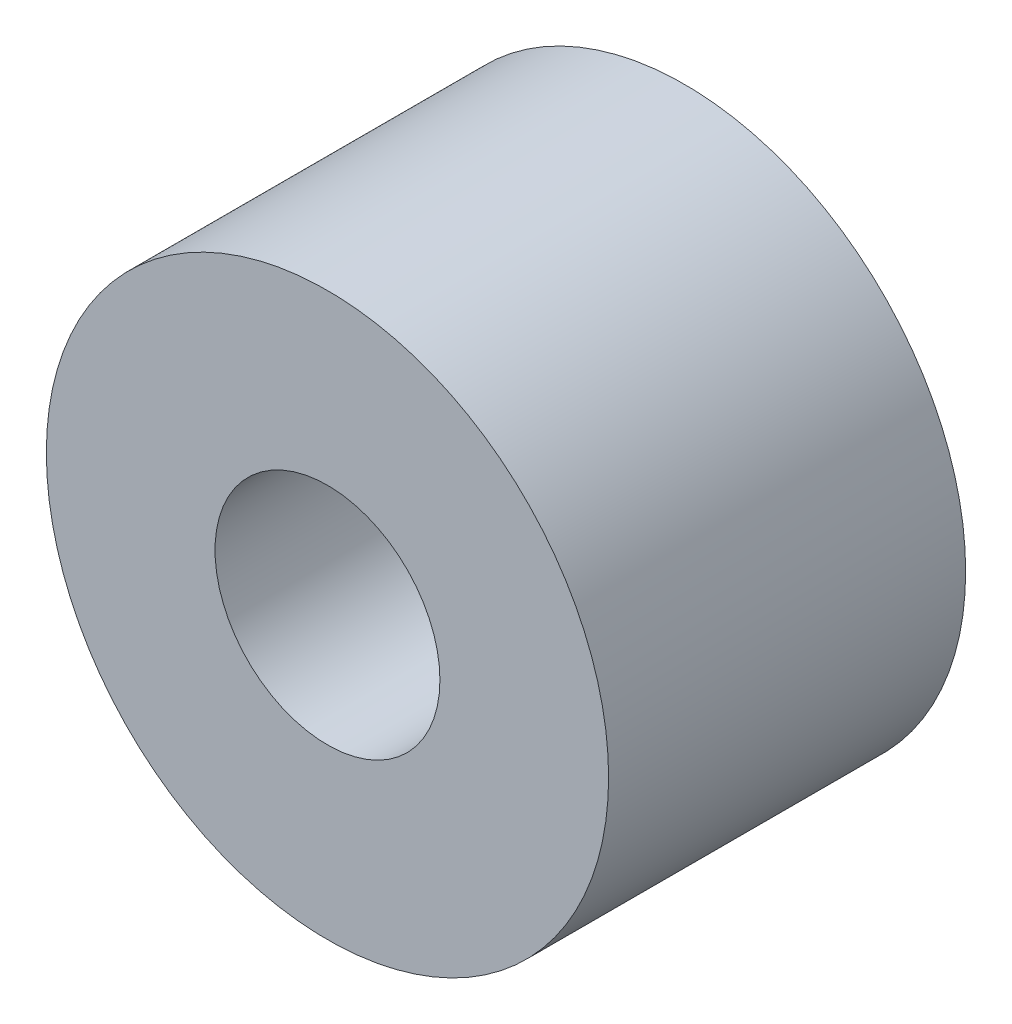
from build123d import *

# Parameters (mm, degrees)
SKETCH1_R           = 5
SKETCH1_R_2         = 2
BOSS_EXTRUDE1_DEPTH = 6.35


with BuildPart() as part:
    # Sketch1 → Boss-Extrude1 (new body)
    with BuildSketch(Plane.XY):
        Circle(SKETCH1_R)
        Circle(SKETCH1_R_2, mode=Mode.SUBTRACT)
    extrude(amount=BOSS_EXTRUDE1_DEPTH)


solid = part.part
